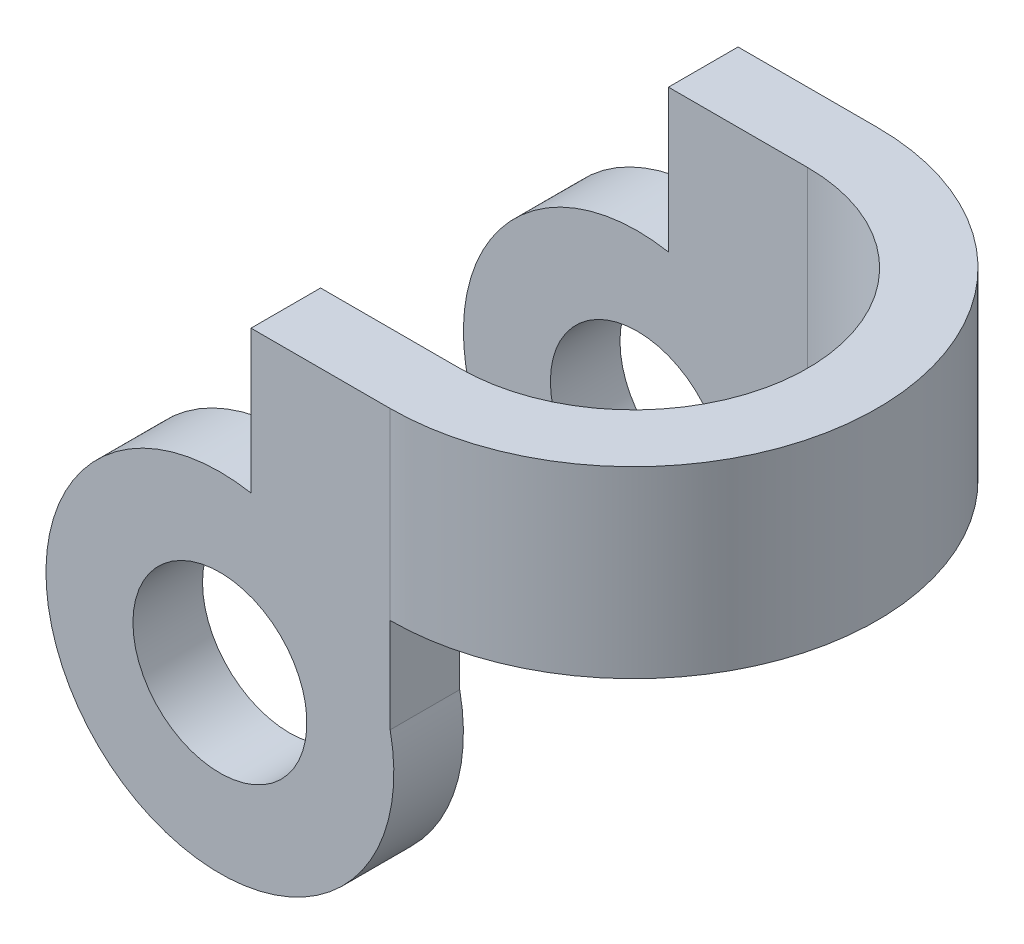
from build123d import *

# Parameters (mm, degrees)
SKETCH1_R           = 12.5
BOSS_EXTRUDE1_DEPTH = 5
SKETCH2_R           = 12.5
BOSS_EXTRUDE2_DEPTH = 5
SKETCH4_W           = 10
SKETCH4_H           = 20
BOSS_EXTRUDE4_DEPTH = 5
SKETCH5_W           = 10
SKETCH5_H           = 20
BOSS_EXTRUDE5_DEPTH = 5
SKETCH8_R           = 6.25
CUT_EXTRUDE2_DEPTH  = 35
SKETCH12_W          = 5
SKETCH12_H          = 13.195782459


with BuildPart() as part:
    # Sketch1 → Boss-Extrude1 (new body)
    with BuildSketch(Plane.XY):
        Circle(SKETCH1_R)
    extrude(amount=BOSS_EXTRUDE1_DEPTH)

    # Sketch4 → Boss-Extrude4 (add)
    with BuildSketch(Plane.XY.offset(5)):
        with Locations((7.235331181, 12.5586463)):
            Rectangle(SKETCH4_W, SKETCH4_H)
    extrude(amount=-BOSS_EXTRUDE4_DEPTH)


with BuildPart() as body_2:
    # Sketch2 → Boss-Extrude2 (new body)
    with BuildSketch(Plane.XY.offset(30)):
        Circle(SKETCH2_R)
    extrude(amount=BOSS_EXTRUDE2_DEPTH)

    # Sketch5 → Boss-Extrude5 (add)
    with BuildSketch(Plane(origin=(0, 0, 30), x_dir=(-1, 0, 0), z_dir=(0, 0, -1))):
        with Locations((-7.235331181, 12.5586463)):
            Rectangle(SKETCH5_W, SKETCH5_H)
    extrude(amount=-BOSS_EXTRUDE5_DEPTH)


with BuildPart() as cut_extrude2_tool:
    # Sketch8 → Cut-Extrude2 (new body)
    with BuildSketch(Plane(origin=(0, 0, 0), x_dir=(-1, 0, 0), z_dir=(0, 0, -1))):
        Circle(SKETCH8_R)
    extrude(amount=-CUT_EXTRUDE2_DEPTH)


with BuildPart() as part_1:
    add(part.part)

    # Cut-Extrude2: cut by cut_extrude2_tool
    add(cut_extrude2_tool.part, mode=Mode.SUBTRACT)



with BuildPart() as body_2_1:
    add(body_2.part)

    # Cut-Extrude2: cut by cut_extrude2_tool
    add(cut_extrude2_tool.part, mode=Mode.SUBTRACT)


with BuildPart() as part_2:
    add(part_1.part)

    add(body_2_1.part)  # Sweep2 merges body 2
    # Sweep2: sweep along a path in Sketch14
    with BuildLine(Plane(origin=(0, 15.960755071, 0), x_dir=(1, 0, 0), z_dir=(0, 1, 0))) as sweep2_path:
        ThreePointArc((12.235331181, -32.5), (27.235331181, -17.5), (12.235331181, -2.5))
    # Sketch12 → Sweep2 (sweep)
    with BuildSketch(Plane(origin=(12.235331181, 0, 0), x_dir=(0, 0, -1), z_dir=(1, 0, 0))):
        with Locations((-32.5, 15.960755071)):
            Rectangle(SKETCH12_W, SKETCH12_H)
    sweep(path=sweep2_path.line)


solid = part_2.part
